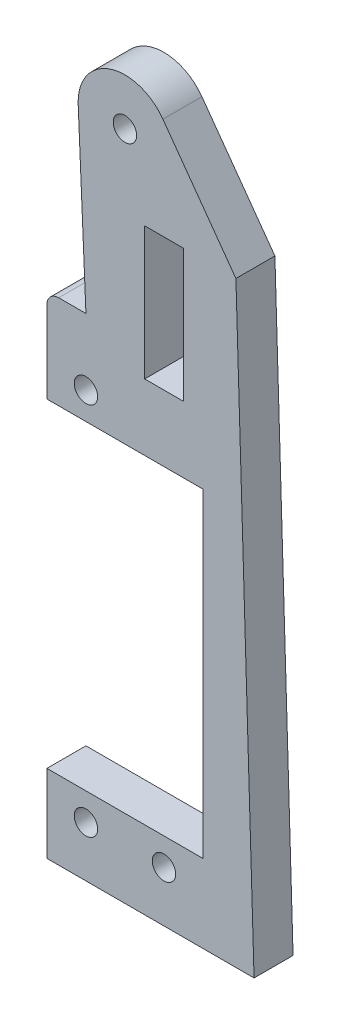
from build123d import *

# Parameters (mm, degrees)
ESQUISSE1_R        = 1.5
ESQUISSE1_W        = 5
ESQUISSE1_H        = 17
BOSS_EXTRU_1_DEPTH = 5
CONG_3_R           = 1.5


with BuildPart() as part:
    # Esquisse1 → Boss.-Extru.1 (new body)
    with BuildSketch(Plane.XY):
        with BuildLine():
            Line((0, 10), (0, 0))
            Line((0, 0), (26.554131445, 0))
            Line((26.554131445, 0), (24.226405413, 76.5))
            Line((24.226405413, 76.5), (14.870448313, 89.504102342))
            ThreePointArc((14.870448313, 89.504102342), (8.034842814, 91.669052587), (4.005728082, 85.7378852))
            Line((4.005728082, 85.7378852), (5, 63))
            Line((5, 63), (0, 63))
            Line((0, 63), (0, 51))
            Line((0, 51), (11, 51))
            Line((11, 51), (20, 51))
            Line((20, 51), (20, 10))
            Line((20, 10), (11, 10))
            Line((11, 10), (0, 10))
        make_face()
        with Locations((5, 54.5)):
            Circle(ESQUISSE1_R, mode=Mode.SUBTRACT)
        with Locations((15, 6.5)):
            Circle(ESQUISSE1_R, mode=Mode.SUBTRACT)
        with Locations((5, 6.5)):
            Circle(ESQUISSE1_R, mode=Mode.SUBTRACT)
        with Locations((10, 86)):
            Circle(ESQUISSE1_R, mode=Mode.SUBTRACT)
        with Locations((15.02885683, 68)):
            Rectangle(ESQUISSE1_W, ESQUISSE1_H, mode=Mode.SUBTRACT)
    extrude(amount=BOSS_EXTRU_1_DEPTH)

    # Congé3
    cong_3_edges = [part.edges().sort_by_distance(p)[0] for p in [
        (0, 63, 2.5),
    ]]
    fillet(cong_3_edges, radius=CONG_3_R)


solid = part.part
